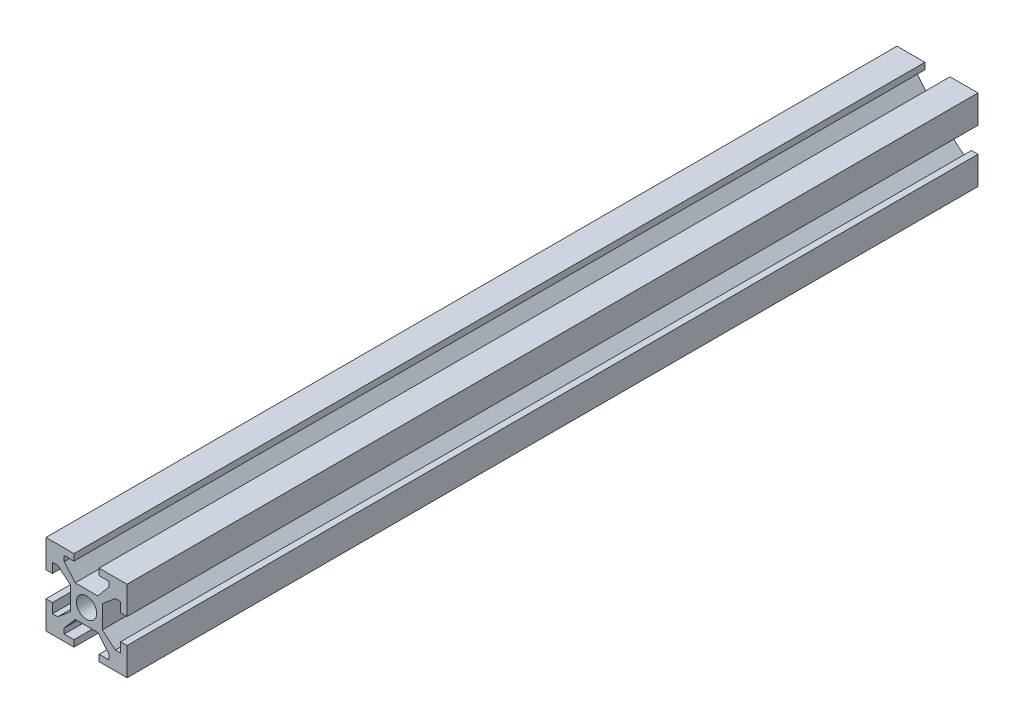
from build123d import *

# Parameters (mm, degrees)
SKETCH_1_R      = 2.5
EXTRUDE_1_DEPTH = 210


with BuildPart() as part:
    # 草图1 → 凸台-拉伸1 (new body)
    with BuildSketch(Plane.XY):
        Polygon((-20, 20), (-13.1, 20), (-13.1, 18.4), (-15.5, 18.4), (-15.5, 17.104298633), (-12.797022805, 13.9), (-7.202977195, 13.9), (-4.5, 17.104298633), (-4.5, 18.4), (-6.9, 18.4), (-6.9, 20), (0, 20), (0, 13.1), (-1.6, 13.1), (-1.6, 15.5), (-2.895701367, 15.5), (-6.1, 12.797022805), (-6.1, 7.202977195), (-2.895701367, 4.5), (-1.6, 4.5), (-1.6, 6.9), (0, 6.9), (0, 0), (-6.9, 0), (-6.9, 1.6), (-4.5, 1.6), (-4.5, 2.895701367), (-7.202977195, 6.1), (-12.797022805, 6.1), (-15.5, 2.895701367), (-15.5, 1.6), (-13.1, 1.6), (-13.1, 0), (-20, 0), (-20, 6.9), (-18.4, 6.9), (-18.4, 4.5), (-17.104298633, 4.5), (-13.9, 7.202977195), (-13.9, 12.797022805), (-17.104298633, 15.5), (-18.4, 15.5), (-18.4, 13.1), (-20, 13.1), align=None)
        with Locations((-10, 10)):
            Circle(SKETCH_1_R, mode=Mode.SUBTRACT)
    extrude(amount=EXTRUDE_1_DEPTH)


solid = part.part
